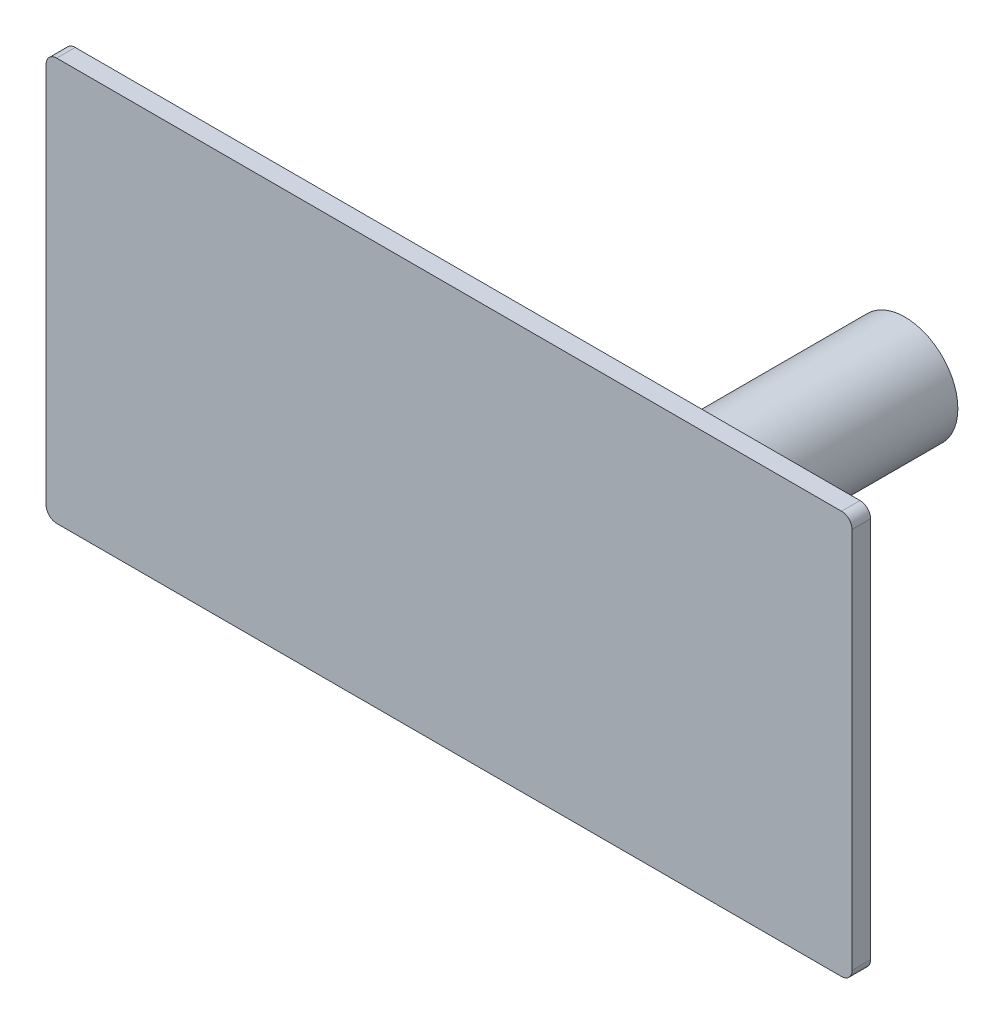
from build123d import *

# Parameters (mm, degrees)
SKETCH1_W           = 76.2
SKETCH1_H           = 38.1
BOSS_EXTRUDE1_DEPTH = 1.75
FILLET1_R           = 1
SKETCH2_R           = 5
BOSS_EXTRUDE2_DEPTH = 30


with BuildPart() as part:
    # Sketch1 → Boss-Extrude1 (new body)
    with BuildSketch(Plane.XY):
        Rectangle(SKETCH1_W, SKETCH1_H)
    extrude(amount=BOSS_EXTRUDE1_DEPTH)

    # Fillet1
    fillet1_edges = [part.edges().sort_by_distance(p)[0] for p in [
        (38.1, -19.05, 0.875),
        (-38.1, -19.05, 0.875),
        (-38.1, 19.05, 0.875),
        (38.1, 19.05, 0.875),
    ]]
    fillet(fillet1_edges, radius=FILLET1_R)

    # Sketch2 → Boss-Extrude2 (add)
    with BuildSketch(Plane.XY.offset(1.75)):
        with Locations((13.1, 2.95)):
            Circle(SKETCH2_R)
    extrude(amount=-BOSS_EXTRUDE2_DEPTH)


solid = part.part
